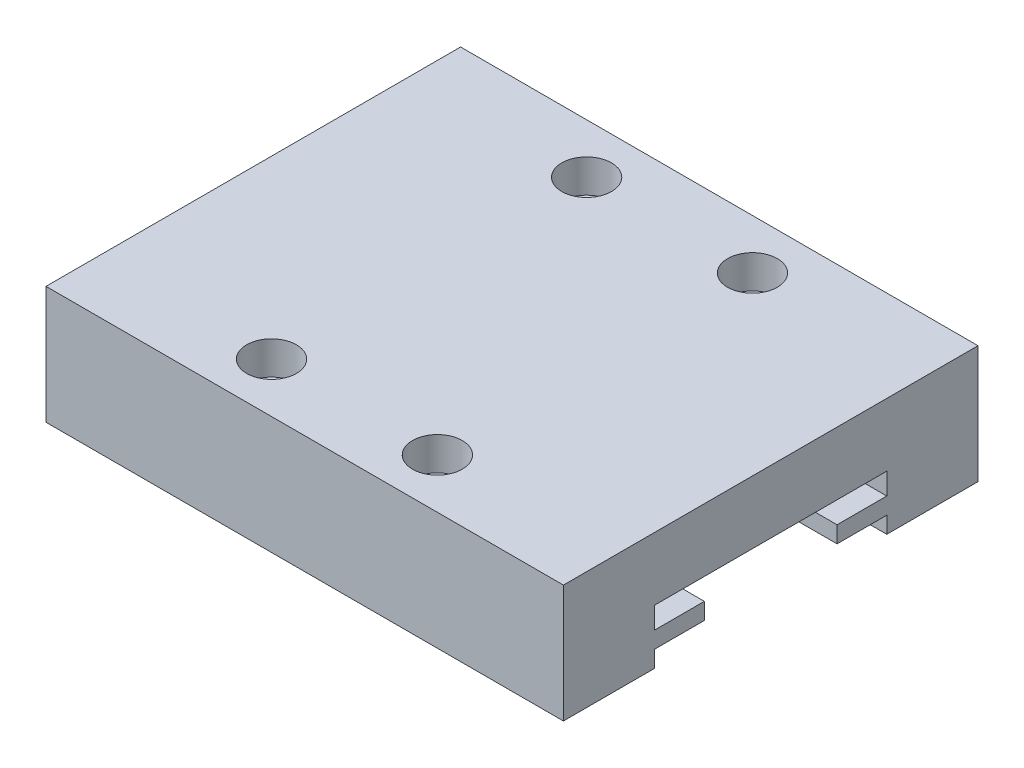
from build123d import *

# Parameters (mm, degrees)
SKETCH_1_W          = 31.2
SKETCH_1_H          = 25
EXTRUDE_1_DEPTH     = 7.1
CUT_EXTRUDE_1_DEPTH = 50.9
SKETCH_3_R          = 1.5
CUT_EXTRUDE_9_DEPTH = 2


with BuildPart() as part:
    # 草图1 → 凸台-拉伸1 (new body)
    with BuildSketch(Plane(origin=(0, 0, 0), x_dir=(1, 0, 0), z_dir=(0, 1, 0))):
        with Locations((15.6, 12.5)):
            Rectangle(SKETCH_1_W, SKETCH_1_H)
    extrude(amount=EXTRUDE_1_DEPTH)

    # 草图2 → 切除-拉伸1 (cut)
    with BuildSketch(Plane.ZY):
        Polygon((-19.5, 0), (-19.5, 1), (-16.5, 1), (-16.5, 2), (-19.5, 2), (-19.5, 3.3), (-12.5, 3.3), (-5.5, 3.3), (-5.5, 2), (-8.5, 2), (-8.5, 1), (-5.5, 1), (-5.5, 0), align=None)
    extrude(amount=-CUT_EXTRUDE_1_DEPTH, mode=Mode.SUBTRACT)

    # 草图3 → 切除-拉伸9 (cut)
    with BuildSketch(Plane(origin=(0, 7.1, 0), x_dir=(1, 0, 0), z_dir=(0, 1, 0))):
        with Locations(Location((10.6, 22, 0), (0, 0, 270))):
            Circle(SKETCH_3_R)
        with Locations(Location((20.6, 22, 0), (0, 0, 90))):
            Circle(SKETCH_3_R)
        with Locations(Location((20.6, 3, 0), (0, 0, 270))):
            Circle(SKETCH_3_R)
        with Locations(Location((10.6, 3, 0), (0, 0, 90))):
            Circle(SKETCH_3_R)
    extrude(amount=-CUT_EXTRUDE_9_DEPTH, mode=Mode.SUBTRACT)


solid = part.part
